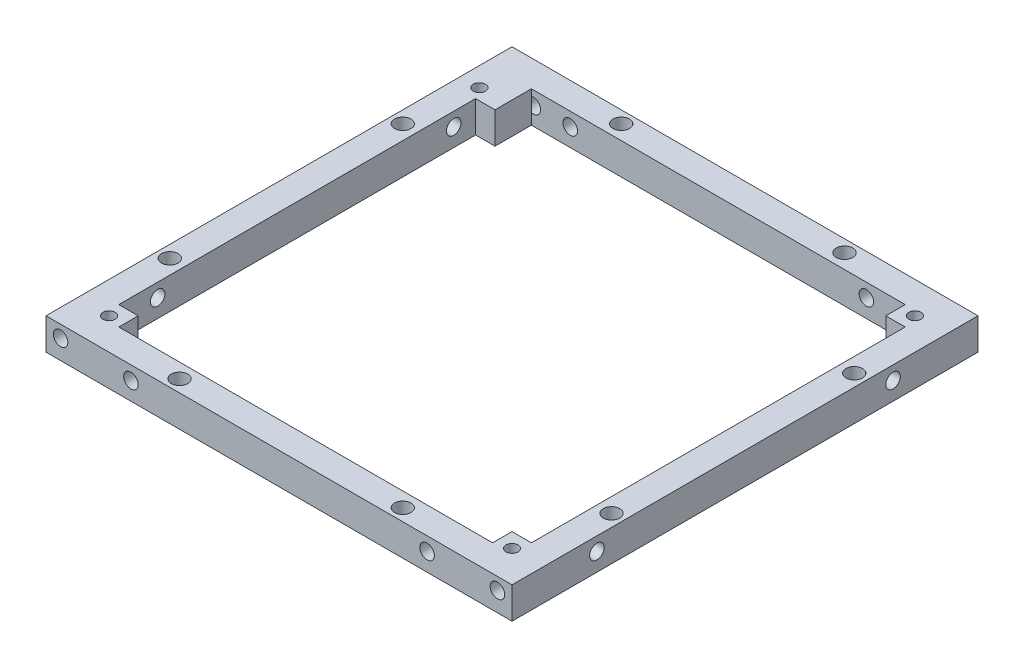
from build123d import *

# Parameters (mm, degrees)
SKETCH1_W                       = 96
SKETCH1_H                       = 96
SKETCH1_W_2                     = 80
SKETCH1_H_2                     = 80
BOSS_EXTRUDE1_DEPTH             = 8
F_3_0_3_DIAMETER_HOLE6_D        = 3
F_3_0_3_DIAMETER_HOLE6_DEPTH    = 7.5
F_3_0_3_DIAMETER_HOLE3_D        = 3
F_3_0_3_DIAMETER_HOLE3_DEPTH    = 7.5
SKETCH27_W                      = 82
SKETCH27_H                      = 82
CUT_EXTRUDE2_DEPTH              = 10
F_3_4_3_4_DIAMETER_HOLE1_D      = 3.4
SKETCH38_W                      = 85
SKETCH38_H                      = 85
CUT_EXTRUDE4_DEPTH              = 10
SKETCH44_W                      = 4
SKETCH44_H                      = 4
BOSS_EXTRUDE2_DEPTH             = 8
SKETCH45_W                      = 4
SKETCH45_H                      = 3.5
BOSS_EXTRUDE3_DEPTH             = 8
TAP_DRILL_FOR_M3X0_5_TAP1_D     = 2.5
SKETCH49_W                      = 96
SKETCH49_H                      = 1.5
CUT_EXTRUDE5_DEPTH              = 146
TAP_DRILL_FOR_M3X0_5_TAP2_D     = 3
TAP_DRILL_FOR_M3X0_5_TAP2_DEPTH = 5.5
TAP_DRILL_FOR_M3X0_5_TAP3_D     = 3
TAP_DRILL_FOR_M3X0_5_TAP3_DEPTH = 5.5
TAP_DRILL_FOR_M3X0_5_TAP4_D     = 3
TAP_DRILL_FOR_M3X0_5_TAP5_D     = 3
TAP_DRILL_FOR_M3X0_5_TAP6_D     = 3
TAP_DRILL_FOR_M3X0_5_TAP6_DEPTH = 5.5


with BuildPart() as part:
    # Sketch1 → Boss-Extrude1 (new body)
    with BuildSketch(Plane(origin=(0, 0, 0), x_dir=(1, 0, 0), z_dir=(0, 1, 0))):
        Rectangle(SKETCH1_W, SKETCH1_H)
        Rectangle(SKETCH1_W_2, SKETCH1_H_2, mode=Mode.SUBTRACT)
    extrude(amount=BOSS_EXTRUDE1_DEPTH)

    # Ø3.0 (3) Diameter Hole6
    with Locations(Plane.XY.offset(48)):
        with Locations((45, 4), (-45, 4)):
            Hole(F_3_0_3_DIAMETER_HOLE6_D / 2, depth=F_3_0_3_DIAMETER_HOLE6_DEPTH)

    # Ø3.0 (3) Diameter Hole3
    with Locations(Plane(origin=(0, 0, -48), x_dir=(-1, 0, 0), z_dir=(0, 0, -1))):
        with Locations((-45, 4), (45, 4)):
            Hole(F_3_0_3_DIAMETER_HOLE3_D / 2, depth=F_3_0_3_DIAMETER_HOLE3_DEPTH)

    # Sketch27 → Cut-Extrude2 (cut)
    with BuildSketch(Plane(origin=(0, 8, 0), x_dir=(1, 0, 0), z_dir=(0, 1, 0))):
        Rectangle(SKETCH27_W, SKETCH27_H)
    extrude(amount=-CUT_EXTRUDE2_DEPTH, mode=Mode.SUBTRACT)

    # Ø3.4 (3.4) Diameter Hole1 (through all)
    with Locations(Plane(origin=(0, 0, 0), x_dir=(-1, 0, 0), z_dir=(0, -1, 0))):
        with Locations((-23, 45.5), (23, 45.5), (45.5, 23), (45.5, -25), (23, -45.5), (-23, -45.5), (-45.5, -25), (-45.5, 25)):
            Hole(F_3_4_3_4_DIAMETER_HOLE1_D / 2)

    # Sketch38 → Cut-Extrude4 (cut)
    with BuildSketch(Plane(origin=(0, 8, 0), x_dir=(1, 0, 0), z_dir=(0, 1, 0))):
        Rectangle(SKETCH38_W, SKETCH38_H)
    extrude(amount=-CUT_EXTRUDE4_DEPTH, mode=Mode.SUBTRACT)

    # Sketch44 → Boss-Extrude2 (add)
    with BuildSketch(Plane.XZ):
        with Locations((40.5, -40.5)):
            Rectangle(SKETCH44_W, SKETCH44_H)
        with Locations((-40.5, -40.5)):
            Rectangle(SKETCH44_W, SKETCH44_H)
        with Locations((-40.5, 40.5)):
            Rectangle(SKETCH44_W, SKETCH44_H)
        with Locations((40.5, 40.5)):
            Rectangle(SKETCH44_W, SKETCH44_H)
    extrude(amount=-BOSS_EXTRUDE2_DEPTH)

    # Sketch45 → Boss-Extrude3 (add)
    with BuildSketch(Plane(origin=(0, 8, 0), x_dir=(1, 0, 0), z_dir=(0, 1, 0))):
        with Locations((-40.5, 36.75)):
            Rectangle(SKETCH45_W, SKETCH45_H)
    extrude(amount=-BOSS_EXTRUDE3_DEPTH)

    # Tap Drill for M3x0.5 Tap1 (through all)
    with Locations(Plane(origin=(0, 8, 0), x_dir=(1, 0, 0), z_dir=(0, 1, 0))):
        with Locations((41.5, 41.5), (41.5, -41.5), (-41.5, -41.5), (-44.05, 37.33)):
            Hole(TAP_DRILL_FOR_M3X0_5_TAP1_D / 2)

    # Sketch49 → Cut-Extrude5 (cut)
    with BuildSketch(Plane(origin=(48, 0, 0), x_dir=(0, 0, -1), z_dir=(1, 0, 0))):
        with Locations((0, 7.25)):
            Rectangle(SKETCH49_W, SKETCH49_H)
    extrude(amount=-CUT_EXTRUDE5_DEPTH, mode=Mode.SUBTRACT)

    # Tap Drill for M3x0.5 Tap2
    with Locations(Plane.ZY.offset(48)):
        with Locations((30.5, 3.7), (-30.5, 3.7)):
            Hole(TAP_DRILL_FOR_M3X0_5_TAP2_D / 2, depth=TAP_DRILL_FOR_M3X0_5_TAP2_DEPTH)

    # Tap Drill for M3x0.5 Tap3
    with Locations(Plane(origin=(0, 0, -48), x_dir=(-1, 0, 0), z_dir=(0, 0, -1))):
        with Locations((30.5, 3.7), (-30.5, 3.7)):
            Hole(TAP_DRILL_FOR_M3X0_5_TAP3_D / 2, depth=TAP_DRILL_FOR_M3X0_5_TAP3_DEPTH)

    # Tap Drill for M3x0.5 Tap4 (through all)
    with Locations(Plane(origin=(48, 0, 0), x_dir=(0, 0, -1), z_dir=(1, 0, 0))):
        with Locations((30.5, 3.7), (-30.5, 3.7)):
            Hole(TAP_DRILL_FOR_M3X0_5_TAP4_D / 2)

    # Tap Drill for M3x0.5 Tap5 (through all)
    with Locations(Plane.XY.offset(48)):
        with Locations((30.5, 3.7), (-30.5, 3.7)):
            Hole(TAP_DRILL_FOR_M3X0_5_TAP5_D / 2)

    # Tap Drill for M3x0.5 Tap6
    with Locations(Plane(origin=(0, 0, -48), x_dir=(-1, 0, 0), z_dir=(0, 0, -1))):
        with Locations((38.1, 3.7), (-38.1, 3.7)):
            Hole(TAP_DRILL_FOR_M3X0_5_TAP6_D / 2, depth=TAP_DRILL_FOR_M3X0_5_TAP6_DEPTH)


solid = part.part
